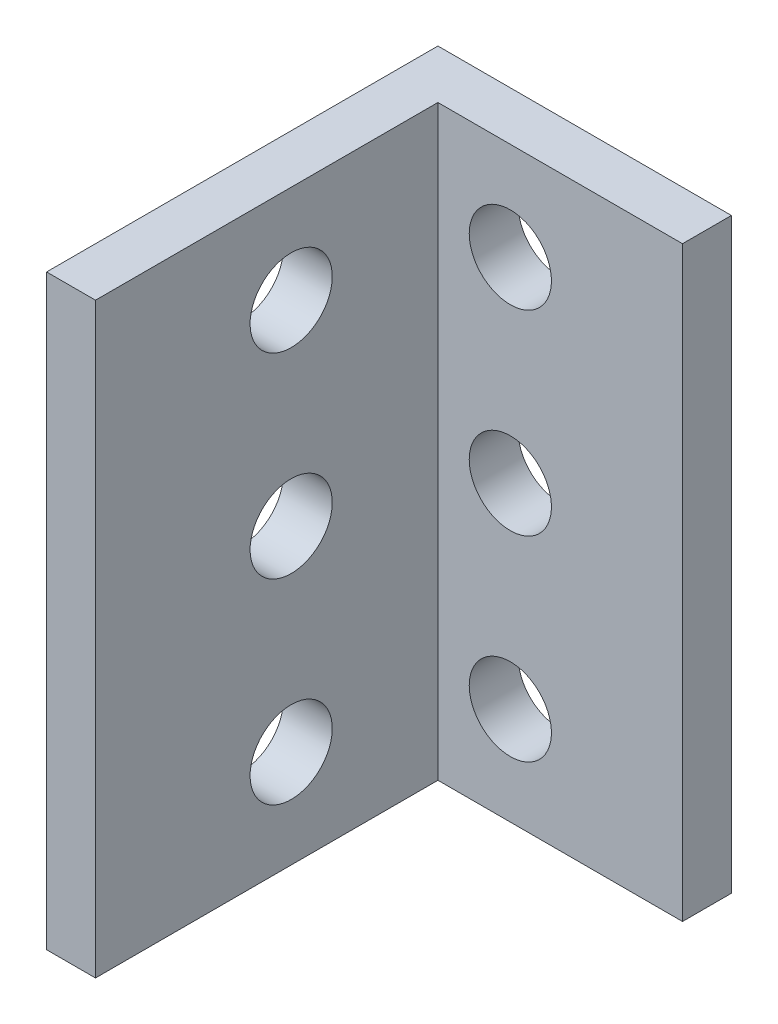
from build123d import *

# Parameters (mm, degrees)
SKETCH1_W           = 19.05
SKETCH1_H           = 38.1
SKETCH1_R           = 2.667
BOSS_EXTRUDE1_DEPTH = 3.175
SKETCH2_W           = 3.175
SKETCH2_H           = 38.1
BOSS_EXTRUDE2_DEPTH = 22.225
SKETCH4_R           = 2.667
CUT_EXTRUDE1_DEPTH  = 36.497579143


with BuildPart() as part:
    # Sketch1 → Boss-Extrude1 (new body)
    with BuildSketch(Plane.XY):
        with Locations((3.175, 0)):
            Rectangle(SKETCH1_W, SKETCH1_H)
        with Locations(Location((1.524, -12.7, 0), (0, 0, 180))):
            Circle(SKETCH1_R, mode=Mode.SUBTRACT)
        with Locations(Location((1.524, 0, 0), (0, 0, 180))):
            Circle(SKETCH1_R, mode=Mode.SUBTRACT)
        with Locations(Location((1.524, 12.7, 0), (0, 0, 180))):
            Circle(SKETCH1_R, mode=Mode.SUBTRACT)
    extrude(amount=BOSS_EXTRUDE1_DEPTH)

    # Sketch2 → Boss-Extrude2 (add)
    with BuildSketch(Plane.XY.offset(3.175)):
        with Locations((-4.7625, 0)):
            Rectangle(SKETCH2_W, SKETCH2_H)
    extrude(amount=BOSS_EXTRUDE2_DEPTH)

    # Sketch4 → Cut-Extrude1 (cut, through all)
    with BuildSketch(Plane(origin=(-3.175, 0, 0), x_dir=(0, 0, -1), z_dir=(1, 0, 0))):
        with Locations(Location((-12.7, 0, 0), (0, 0, 90))):
            Circle(SKETCH4_R)
        with Locations(Location((-12.7, 12.7, 0), (0, 0, 90))):
            Circle(SKETCH4_R)
        with Locations(Location((-12.7, -12.7, 0), (0, 0, 90))):
            Circle(SKETCH4_R)
    extrude(amount=-CUT_EXTRUDE1_DEPTH, mode=Mode.SUBTRACT)


solid = part.part
